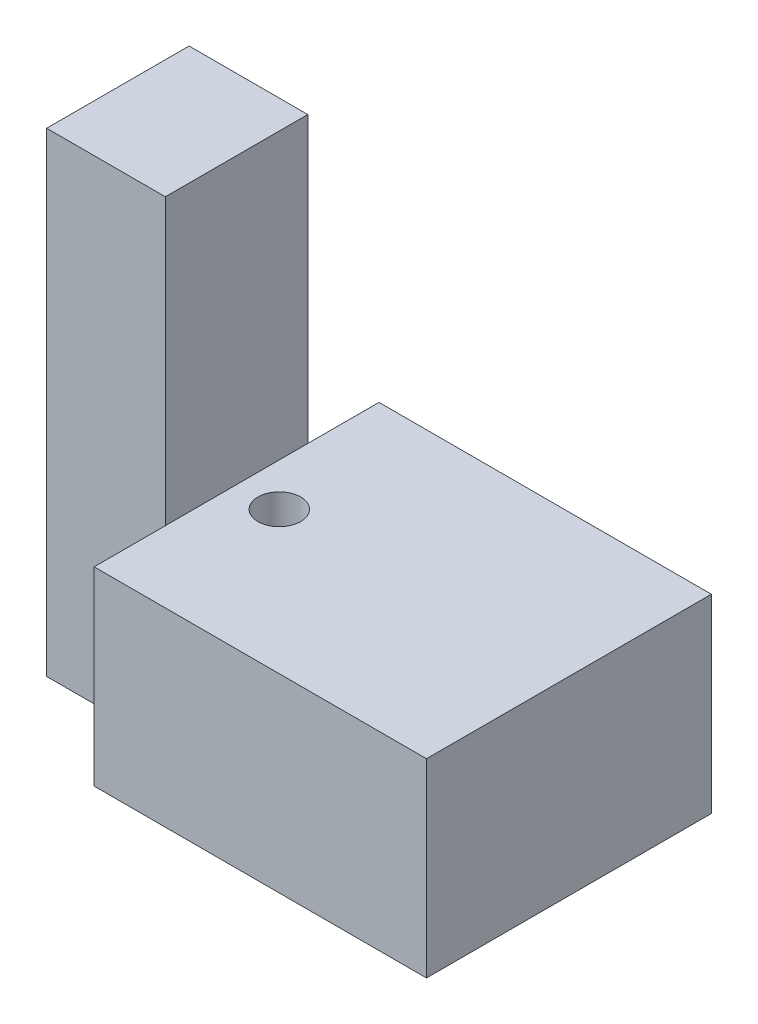
from build123d import *

# Parameters (mm, degrees)
ESQUISSE1_W             = 70
ESQUISSE1_H             = 40
BOSS_EXTRU_1_DEPTH      = 60
ESQUISSE2_R             = 4.5
ENL_V_MAT_EXTRU_1_DEPTH = 60
ESQUISSE3_W             = 30
ESQUISSE3_H             = 40
BOSS_EXTRU_2_DEPTH      = 25
ESQUISSE4_W             = 25
ESQUISSE4_H             = 30
BOSS_EXTRU_3_DEPTH      = 60


with BuildPart() as part:
    # Esquisse1 → Boss.-Extru.1 (new body)
    with BuildSketch(Plane.XY):
        with Locations((-34.135092282, 3.264127517)):
            Rectangle(ESQUISSE1_W, ESQUISSE1_H)
    extrude(amount=BOSS_EXTRU_1_DEPTH)

    # Esquisse2 → Enlèv. mat.-Extru.1 (cut)
    with BuildSketch(Plane(origin=(0, 23.264127517, 0), x_dir=(1, 0, 0), z_dir=(0, 1, 0))):
        with Locations(Location((-60.135092282, -30, 0), (0, 0, 270))):
            Circle(ESQUISSE2_R)
    extrude(amount=-ENL_V_MAT_EXTRU_1_DEPTH, mode=Mode.SUBTRACT)

    # Esquisse3 → Boss.-Extru.2 (add)
    with BuildSketch(Plane.ZY.offset(69.135092282)):
        with Locations((30, 3.264127517)):
            Rectangle(ESQUISSE3_W, ESQUISSE3_H)
    extrude(amount=BOSS_EXTRU_2_DEPTH)

    # Esquisse4 → Boss.-Extru.3 (add)
    with BuildSketch(Plane(origin=(0, 23.264127517, 0), x_dir=(1, 0, 0), z_dir=(0, 1, 0))):
        with Locations((-81.635092282, -30)):
            Rectangle(ESQUISSE4_W, ESQUISSE4_H)
    extrude(amount=BOSS_EXTRU_3_DEPTH)


solid = part.part
